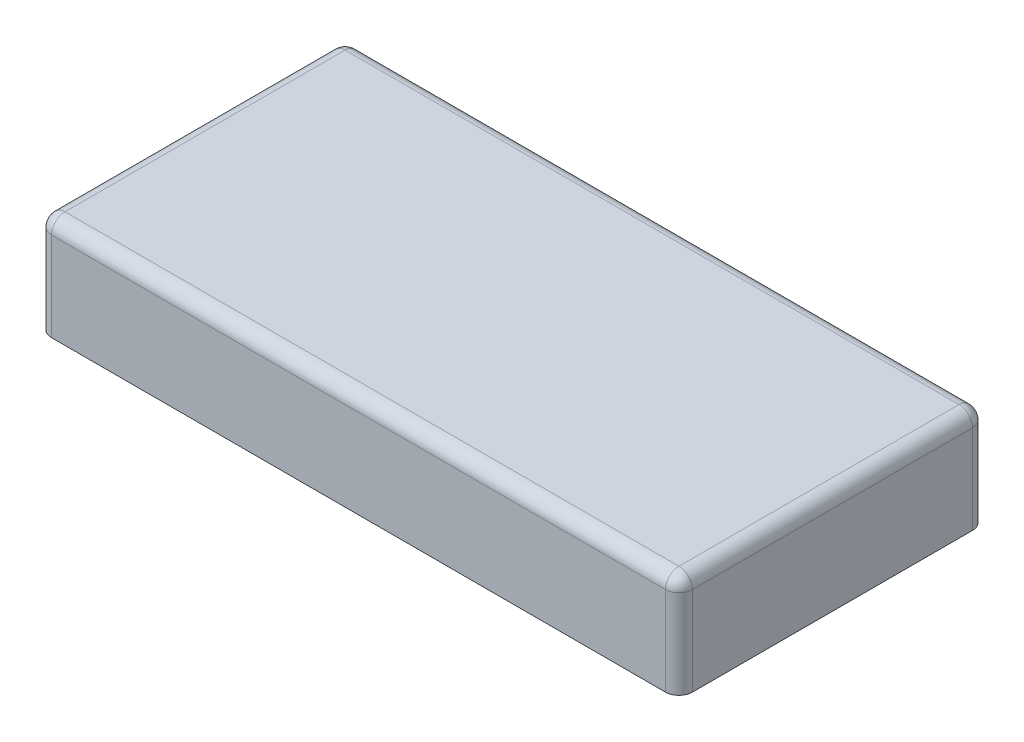
from build123d import *

# Parameters (mm, degrees)
SKETCH_2_W          = 47.600012207
SKETCH_2_H          = 22.800017408
SKETCH_2_W_2        = 45.600012207
SKETCH_2_H_2        = 20.800017408
EXTRUDE_1_DEPTH     = 1.6
SKETCH_3_W          = 47.600012207
SKETCH_3_H          = 22.800017408
SKETCH_3_W_2        = 45.600012207
SKETCH_3_H_2        = 20.800017408
EXTRUDE_2_DEPTH     = 2
SKETCH_4_W          = 47.600012207
SKETCH_4_H          = 22.800017408
EXTRUDE_3_DEPTH     = 1
SKETCH_5_W          = 47.600012207
SKETCH_5_H          = 22.800017408
SKETCH_5_W_2        = 45.600012207
SKETCH_5_H_2        = 20.800017408
EXTRUDE_4_DEPTH     = 3
SKETCH_6_W          = 8.6
SKETCH_6_H          = 2.628886846
SKETCH_6_W_2        = 13
SKETCH_6_H_2        = 3.428886378
SKETCH_6_W_3        = 10.5
SKETCH_6_H_3        = 3.428887043
CUT_EXTRUDE_1_DEPTH = 1
SKETCH_7_W          = 1.599774972
SKETCH_7_H          = 0.5
SKETCH_7_W_2        = 6.350027001
CUT_EXTRUDE_2_DEPTH = 1
FILLET_1_R          = 1


with BuildPart() as part:
    # Эскиз2 → Бобышка-Вытянуть1 (new body)
    with BuildSketch(Plane(origin=(0, 1.271117687, 0), x_dir=(1, 0, 0), z_dir=(0, 1, 0))):
        with Locations((22.600006104, 10.200008704)):
            Rectangle(SKETCH_2_W, SKETCH_2_H)
        with Locations((22.600006104, 10.200008704)):
            Rectangle(SKETCH_2_W_2, SKETCH_2_H_2, mode=Mode.SUBTRACT)
    extrude(amount=-EXTRUDE_1_DEPTH)

    # Эскиз3 → Бобышка-Вытянуть2 (add)
    with BuildSketch(Plane(origin=(0, 1.271117687, 0), x_dir=(1, 0, 0), z_dir=(0, 1, 0))):
        with Locations((22.600006104, 10.200008704)):
            Rectangle(SKETCH_3_W, SKETCH_3_H)
        with Locations((22.600006104, 10.200008704)):
            Rectangle(SKETCH_3_W_2, SKETCH_3_H_2, mode=Mode.SUBTRACT)
    extrude(amount=EXTRUDE_2_DEPTH)

    # Эскиз4 → Бобышка-Вытянуть3 (add)
    with BuildSketch(Plane(origin=(0, 3.271117687, 0), x_dir=(1, 0, 0), z_dir=(0, 1, 0))):
        with Locations((22.600006104, 10.200008704)):
            Rectangle(SKETCH_4_W, SKETCH_4_H)
    extrude(amount=EXTRUDE_3_DEPTH)

    # Эскиз5 → Бобышка-Вытянуть4 (add)
    with BuildSketch(Plane.XZ.offset(0.328882313)):
        with Locations((22.600006104, -10.200008704)):
            Rectangle(SKETCH_5_W, SKETCH_5_H)
        with Locations((22.600006104, -10.200008704)):
            Rectangle(SKETCH_5_W_2, SKETCH_5_H_2, mode=Mode.SUBTRACT)
    extrude(amount=EXTRUDE_4_DEPTH)

    # Эскиз6 → Вырез-Вытянуть1 (cut)
    with BuildSketch(Plane(origin=(0, 0, -21.600017408), x_dir=(-1, 0, 0), z_dir=(0, 0, -1))):
        with Locations((-21.299859449, -2.01443889)):
            Rectangle(SKETCH_6_W, SKETCH_6_H)
        with Locations((-8.900084477, -1.614439124)):
            Rectangle(SKETCH_6_W_2, SKETCH_6_H_2)
        with Locations((-37.19988645, -1.614438792)):
            Rectangle(SKETCH_6_W_3, SKETCH_6_H_3)
    extrude(amount=-CUT_EXTRUDE_1_DEPTH, mode=Mode.SUBTRACT)

    # Эскиз7 → Вырез-Вытянуть2 (cut)
    with BuildSketch(Plane.XZ.offset(3.328882313)):
        Polygon((-0.2, 0.2), (45.400012207, 0.2), (45.400012207, -20.600017408), (42.44988645, -20.600017408), (42.44988645, -21.100017408), (45.900012207, -21.100017408), (45.900012207, 0.7), (-0.7, 0.7), (-0.7, -21.100017408), (2.400084477, -21.100017408), (2.400084477, -20.600017408), (-0.2, -20.600017408), align=None)
        with Locations((16.199971963, -20.850017408)):
            Rectangle(SKETCH_7_W, SKETCH_7_H)
        with Locations((28.77487295, -20.850017408)):
            Rectangle(SKETCH_7_W_2, SKETCH_7_H)
    extrude(amount=-CUT_EXTRUDE_2_DEPTH, mode=Mode.SUBTRACT)

    # Скругление1
    fillet_1_edges = [part.edges().sort_by_distance(p)[0] for p in [
        (46.400012207, 4.271117687, -10.200008704),
        (22.600006104, 4.271117687, -21.600017408),
        (-1.2, 4.271117687, -10.200008704),
        (22.600006104, 4.271117687, 1.2),
        (-1.2, 0.471117687, 1.2),
        (-1.2, 0.471117687, -21.600017408),
        (46.400012207, 0.471117687, -21.600017408),
        (46.400012207, 0.471117687, 1.2),
    ]]
    fillet(fillet_1_edges, radius=FILLET_1_R)


solid = part.part
